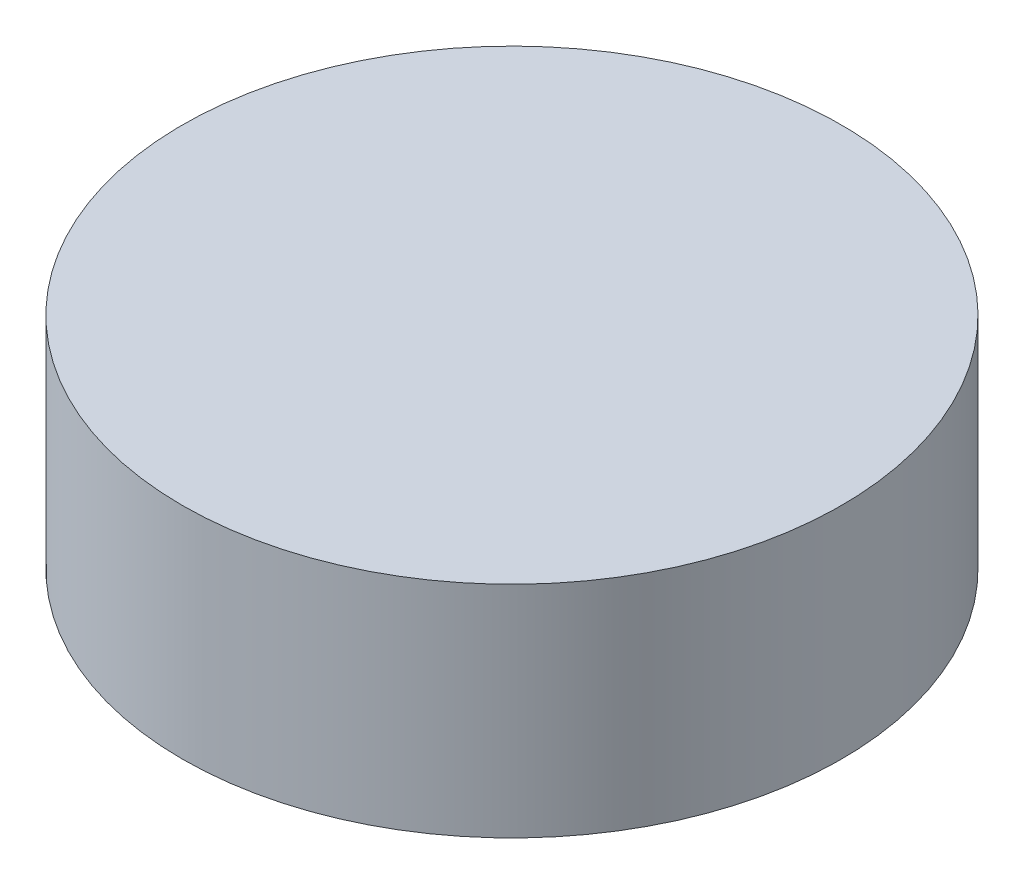
from build123d import *

# Parameters (mm, degrees)
SKETCH_1_R      = 3
EXTRUDE_1_DEPTH = 2


with BuildPart() as part:
    # 草图1 → 凸台-拉伸1 (new body)
    with BuildSketch(Plane(origin=(0, 0, 0), x_dir=(1, 0, 0), z_dir=(0, 1, 0))):
        with Locations(Location((0, 0, 0), (0, 0, 270))):
            Circle(SKETCH_1_R)
    extrude(amount=EXTRUDE_1_DEPTH)


solid = part.part
